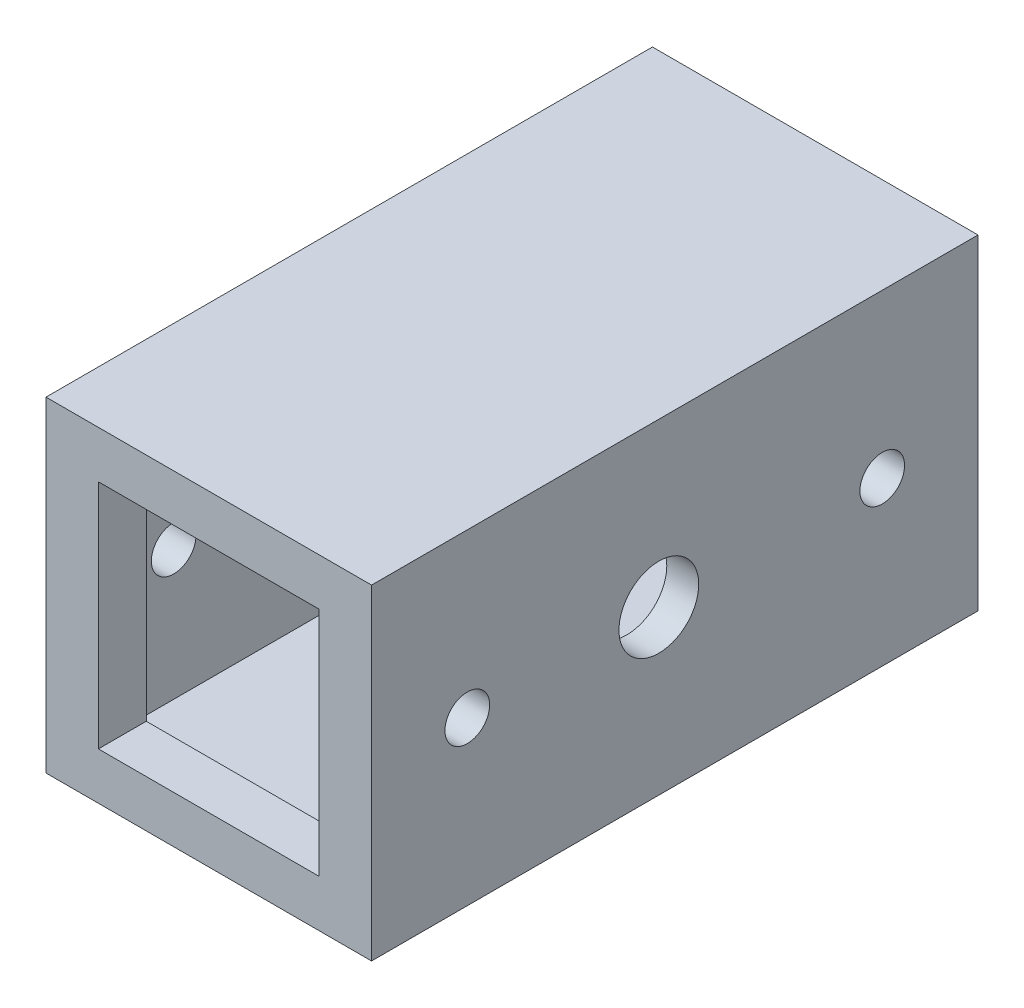
from build123d import *

# Parameters (mm, degrees)
SKETCH1_W           = 20.4
SKETCH1_H           = 20.4
SKETCH1_W_2         = 16.4
SKETCH1_H_2         = 16.4
BOSS_EXTRUDE1_DEPTH = 35
SKETCH2_W           = 20.4
SKETCH2_H           = 20.4
SKETCH2_W_2         = 13.834702386
SKETCH2_H_2         = 14.497254018
BOSS_EXTRUDE2_DEPTH = 3
SKETCH3_R           = 1.4
SKETCH3_R_2         = 2.5
CUT_EXTRUDE1_DEPTH  = 42.775590959
FILLET1_R           = 1


with BuildPart() as part:
    # Sketch1 → Boss-Extrude1 (new body)
    with BuildSketch(Plane.XY):
        Rectangle(SKETCH1_W, SKETCH1_H)
        Rectangle(SKETCH1_W_2, SKETCH1_H_2, mode=Mode.SUBTRACT)
    extrude(amount=-BOSS_EXTRUDE1_DEPTH)

    # Sketch2 → Boss-Extrude2 (add)
    with BuildSketch(Plane.XY):
        Rectangle(SKETCH2_W, SKETCH2_H)
        Rectangle(SKETCH2_W_2, SKETCH2_H_2, mode=Mode.SUBTRACT)
    extrude(amount=BOSS_EXTRUDE2_DEPTH)

    # Sketch3 → Cut-Extrude1 (cut, through all)
    with BuildSketch(Plane(origin=(10.2, 0, 0), x_dir=(0, 0, -1), z_dir=(1, 0, 0))):
        with Locations((3, 0)):
            Circle(SKETCH3_R)
        with Locations((29, 0)):
            Circle(SKETCH3_R)
        with Locations((15, 0)):
            Circle(SKETCH3_R_2)
    extrude(amount=-CUT_EXTRUDE1_DEPTH, mode=Mode.SUBTRACT)

    # Fillet1
    fillet1_edges = [part.edges().sort_by_distance(p)[0] for p in [
        (-8.2, 0, -35),
        (0, -8.2, -35),
        (8.2, 0, -35),
        (0, 8.2, -35),
    ]]
    fillet(fillet1_edges, radius=FILLET1_R)


solid = part.part
